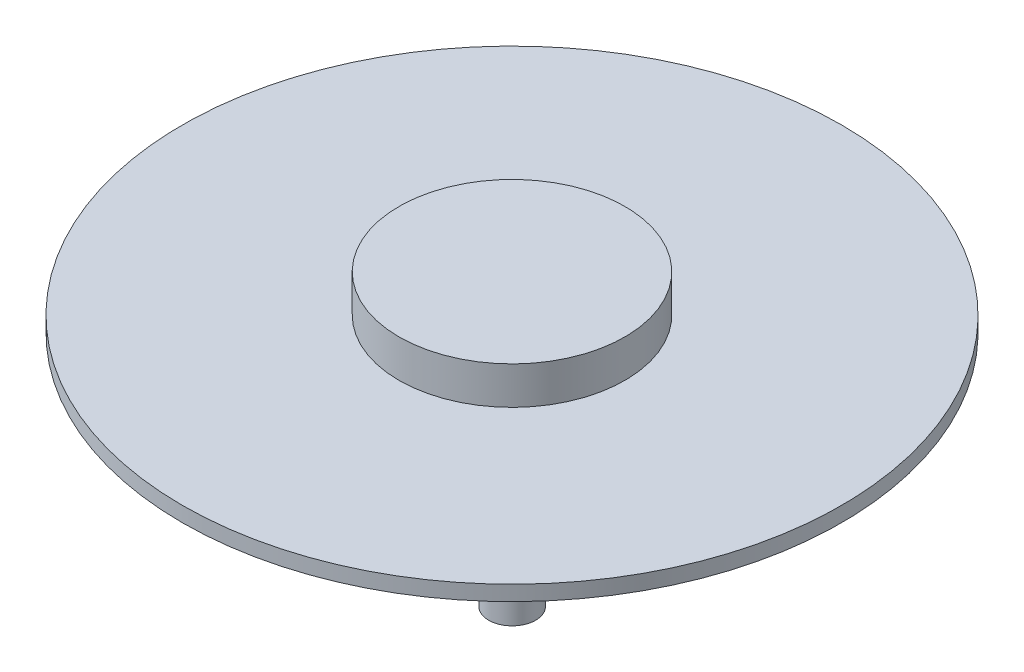
from build123d import *

# Parameters (mm, degrees)
SK_P01_STANDOFF_R           = 2.5
P01_STANDOFF_DEPTH          = 4
SK_P02_STANDOFF_R           = 2.5
P02_STANDOFF_DEPTH          = 4
SK_P03_STANDOFF_R           = 2.5
P03_STANDOFF_DEPTH          = 4
SK_P04_STANDOFF_R           = 2.5
P04_STANDOFF_DEPTH          = 4
P05_MICARRAYBOARD70MM_START = 4
SK_P05_MICARRAYBOARD70MM_R  = 35
P05_MICARRAYBOARD70MM_DEPTH = 1.6
P06_DSPANDLEDS_START        = 5.6
SK_P06_DSPANDLEDS_R         = 12
P06_DSPANDLEDS_DEPTH        = 4


with BuildPart() as part:
    # SK_P01_Standoff → P01_Standoff (new body)
    with BuildSketch(Plane(origin=(0, 0, 0), x_dir=(1, 0, 0), z_dir=(0, 1, 0))):
        with Locations(Location((21.222, -21.205, 0), (0, 0, 270))):
            Circle(SK_P01_STANDOFF_R)
    extrude(amount=P01_STANDOFF_DEPTH)



with BuildPart() as body_2:
    # SK_P02_Standoff → P02_Standoff (new body)
    with BuildSketch(Plane(origin=(0, 0, 0), x_dir=(1, 0, 0), z_dir=(0, 1, 0))):
        with Locations(Location((-21.209, -21.217, 0), (0, 0, 270))):
            Circle(SK_P02_STANDOFF_R)
    extrude(amount=P02_STANDOFF_DEPTH)


with BuildPart() as body_3:
    # SK_P03_Standoff → P03_Standoff (new body)
    with BuildSketch(Plane(origin=(0, 0, 0), x_dir=(1, 0, 0), z_dir=(0, 1, 0))):
        with Locations(Location((-21.213, 21.213, 0), (0, 0, 270))):
            Circle(SK_P03_STANDOFF_R)
    extrude(amount=P03_STANDOFF_DEPTH)


with BuildPart() as body_4:
    # SK_P04_Standoff → P04_Standoff (new body)
    with BuildSketch(Plane(origin=(0, 0, 0), x_dir=(1, 0, 0), z_dir=(0, 1, 0))):
        with Locations(Location((21.218, 21.209, 0), (0, 0, 270))):
            Circle(SK_P04_STANDOFF_R)
    extrude(amount=P04_STANDOFF_DEPTH)


with BuildPart() as part_1:
    add(part.part)

    add(body_2.part)  # P05_Micarrayboard70mm merges body 2

    add(body_3.part)  # P05_Micarrayboard70mm merges body 3

    add(body_4.part)  # P05_Micarrayboard70mm merges body 4
    # SK_P05_Micarrayboard70mm → P05_Micarrayboard70mm (add)
    with BuildSketch(Plane(origin=(0, 0, 0), x_dir=(1, 0, 0), z_dir=(0, 1, 0)).offset(P05_MICARRAYBOARD70MM_START)):
        with Locations(Location((0, 0, 0), (0, 0, 270))):
            Circle(SK_P05_MICARRAYBOARD70MM_R)
    extrude(amount=P05_MICARRAYBOARD70MM_DEPTH)

    # SK_P06_DSPandLEDs → P06_DSPandLEDs (add)
    with BuildSketch(Plane(origin=(0, 0, 0), x_dir=(1, 0, 0), z_dir=(0, 1, 0)).offset(P06_DSPANDLEDS_START)):
        with Locations(Location((0, 0, 0), (0, 0, 270))):
            Circle(SK_P06_DSPANDLEDS_R)
    extrude(amount=P06_DSPANDLEDS_DEPTH)


solid = part_1.part
